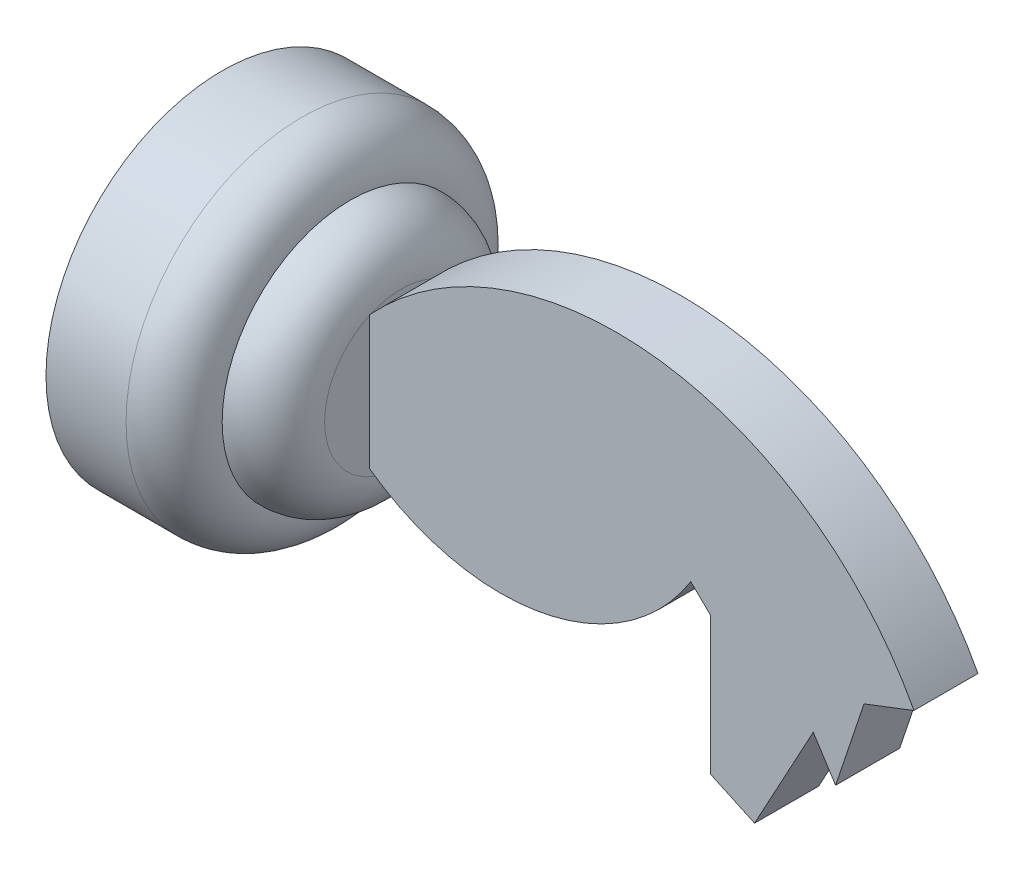
from build123d import *

# Parameters (mm, degrees)
EXTRUDE_2643_DEPTH = 2


with BuildPart() as part:
    # Sketch 219 → Повернуть1 (revolve)
    with BuildSketch(Plane.XY):
        with BuildLine():
            Line((0, 11), (0, 0))
            Line((0, 0), (11.2, 0))
            Line((11.2, 0), (11.2, 4.8))
            ThreePointArc((11.2, 4.8), (10.2627417, 7.0627417), (8, 8))
            ThreePointArc((8, 8), (7.121320344, 10.121320344), (5, 11))
            Line((5, 11), (0, 11))
        make_face()
    revolve(axis=Axis((0, 0, 0), (1, 0, 0)))

    # Sketch 1503 → Extrude 2643 (add, symmetric)
    with BuildSketch(Plane.XY):
        with BuildLine():
            Line((11.2, 4.4), (11.2, -3.914978255))
            ThreePointArc((11.2, -3.914978255), (22.080678837, -6.30816882), (31.263463773, 0))
            Line((31.263463773, 0), (32.498964702, -1.197255299))
            Line((32.498964702, -1.197255299), (32.498964702, -9.797255299))
            Line((32.498964702, -9.797255299), (35.248695767, -11.07))
            Line((35.248695767, -11.07), (38.912013935, -4.32))
            Line((38.912013935, -4.32), (40.307542508, -6.49))
            Line((40.307542508, -6.49), (42.083014277, -1.2))
            Line((42.083014277, -1.2), (45.2, 0))
            ThreePointArc((45.2, 0), (29.338267199, 10.995701086), (11.2, 4.4))
        make_face()
    extrude(amount=EXTRUDE_2643_DEPTH, both=True)

    # попа<16> → Повернуть2 (revolve)
    with BuildSketch(Plane.XY):
        with BuildLine():
            ThreePointArc((8, 8), (7.121320344, 10.121320344), (5, 11))
            Line((5, 11), (5, 0))
            Line((5, 0), (8, 0))
            Line((8, 0), (8, 8))
        make_face()
    revolve(axis=Axis((0, 0, 0), (1, 0, 0)))


solid = part.part
